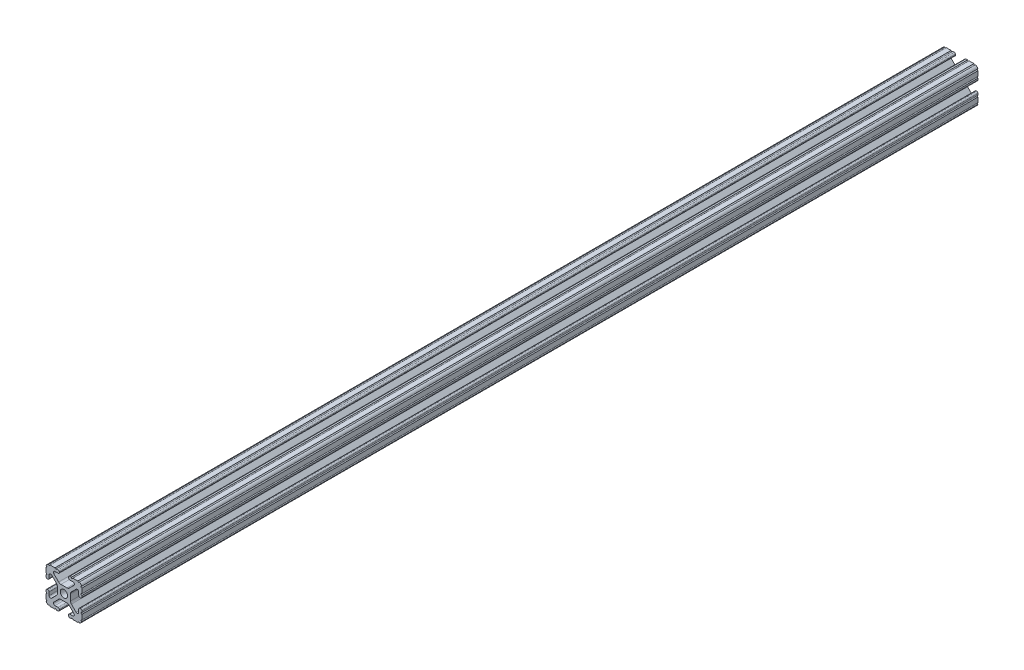
from build123d import *

# Parameters (mm, degrees)
BOSS_EXTRUDE1_DEPTH     = 1524
CUT_EXTRUDE1_DEPTH      = 1525.105829659
CUT_EXTRUDE1_DEPTH_BACK = 1525.105829659
SKETCH5_R               = 0.55245
CUT_EXTRUDE2_DEPTH      = 1525.105829659
CUT_EXTRUDE2_DEPTH_BACK = 1525.105829659
SKETCH8_W               = 50.559993734
SKETCH8_H               = 1231.9
CUT_EXTRUDE3_DEPTH      = 1525.105829659
CUT_EXTRUDE3_DEPTH_BACK = 1525.105829659
SKETCH9_W               = 50.679996867
SKETCH9_H               = 1206.5


with BuildPart() as part:
    # Sketch4 → Boss-Extrude1 (new, symmetric)
    with BuildSketch(Plane.XY):
        with BuildLine():
            Line((4.190365, -12.7), (10.11729625, -12.7))
            ThreePointArc((10.11729625, -12.7), (11.943543585, -11.943543585), (12.7, -10.11729625))
            Line((12.7, -10.11729625), (12.7, -4.190365))
            ThreePointArc((12.7, -4.190365), (12.42492494, -3.52627506), (11.760835, -3.2512))
            Line((11.760835, -3.2512), (11.429365, -3.2512))
            ThreePointArc((11.429365, -3.2512), (10.76527506, -3.52627506), (10.4902, -4.190365))
            Line((10.4902, -4.190365), (10.4902, -6.348478019))
            ThreePointArc((10.4902, -6.348478019), (9.830707141, -7.335478831), (8.666460301, -7.103895736))
            Line((8.666460301, -7.103895736), (5.299899128, -3.737334563))
            ThreePointArc((5.299899128, -3.737334563), (4.817571085, -3.015479634), (4.6482, -2.16399369))
            Line((4.6482, -2.16399369), (4.6482, 0))
            Line((4.6482, 0), (2.6035, 0))
            ThreePointArc((2.6035, 0), (1.840952505, -1.840952505), (0, -2.6035))
            Line((0, -2.6035), (0, -4.6482))
            Line((0, -4.6482), (2.16399369, -4.6482))
            ThreePointArc((2.16399369, -4.6482), (3.015479634, -4.817571085), (3.737334563, -5.299899128))
            Line((3.737334563, -5.299899128), (7.103895736, -8.666460301))
            ThreePointArc((7.103895736, -8.666460301), (7.335478831, -9.830707141), (6.348478019, -10.4902))
            Line((6.348478019, -10.4902), (4.190365, -10.4902))
            ThreePointArc((4.190365, -10.4902), (3.52627506, -10.76527506), (3.2512, -11.429365))
            Line((3.2512, -11.429365), (3.2512, -11.760835))
            ThreePointArc((3.2512, -11.760835), (3.52627506, -12.42492494), (4.190365, -12.7))
        make_face()
    extrude(amount=BOSS_EXTRUDE1_DEPTH, both=True)

    # Sketch5 → Cut-Extrude1 (cut, two sides: drawn at the far end of the back side and taken through both)
    with BuildSketch(Plane.XY.offset(-CUT_EXTRUDE1_DEPTH_BACK)):
        with Locations((10.356153152, -12.7)):
            Circle(SKETCH5_R)
        with Locations((5.796028019, -12.7)):
            Circle(SKETCH5_R)
        with Locations((12.7, -10.356153152)):
            Circle(SKETCH5_R)
        with Locations((12.7, -5.796028019)):
            Circle(SKETCH5_R)
    extrude(amount=CUT_EXTRUDE1_DEPTH + CUT_EXTRUDE1_DEPTH_BACK, mode=Mode.SUBTRACT)

    # Mirror1: part across plane


with BuildPart() as part_1:
    add(part.part)
    add(part.part.mirror(Plane(origin=(0, 0, 0), x_dir=(0, 0, 1), z_dir=(1, 0, 0))))

    # Mirror2: part across plane


with BuildPart() as part_2:
    add(part_1.part)
    add(part_1.part.mirror(Plane.ZX))

    # Sketch8 → Cut-Extrude2 (cut, two sides: drawn at the far end of the back side and taken through both)
    with BuildSketch(Plane(origin=(0, 0, 0), x_dir=(1, 0, 0), z_dir=(0, 1, 0)).offset(-CUT_EXTRUDE2_DEPTH_BACK)):
        with Locations((0, 920.75)):
            Rectangle(SKETCH8_W, SKETCH8_H)
    extrude(amount=CUT_EXTRUDE2_DEPTH + CUT_EXTRUDE2_DEPTH_BACK, mode=Mode.SUBTRACT)

    # Sketch9 → Cut-Extrude3 (cut, two sides: drawn at the far end of the back side and taken through both)
    with BuildSketch(Plane(origin=(0, 0, 0), x_dir=(1, 0, 0), z_dir=(0, 1, 0)).offset(-CUT_EXTRUDE3_DEPTH_BACK)):
        with Locations((-0.060001567, -285.75)):
            Rectangle(SKETCH9_W, SKETCH9_H)
    extrude(amount=CUT_EXTRUDE3_DEPTH + CUT_EXTRUDE3_DEPTH_BACK, mode=Mode.SUBTRACT)


solid = part_2.part
